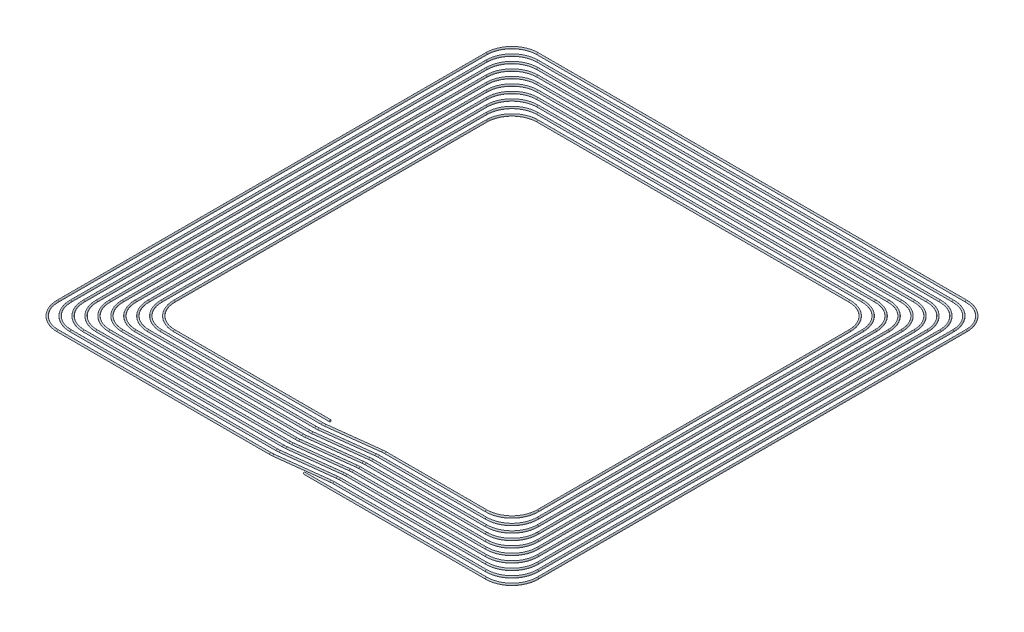
from build123d import *

# Parameters (mm, degrees)
SKETCH_2_R = 0.5


with BuildPart() as part:
    # 扫描1: sweep along a path in 草图1
    with BuildLine(Plane(origin=(0, 0, 0), x_dir=(1, 0, 0), z_dir=(0, 1, 0))) as sweep_1_path:
        Line((140, -245.98), (49.02, -245.98))
        ThreePointArc((49.02, -245.98), (38.413398282, -241.586601718), (34.02, -230.98))
        Line((34.02, -230.98), (34.02, -49.02))
        ThreePointArc((34.02, -49.02), (38.413398282, -38.413398282), (49.02, -34.02))
        Line((49.02, -34.02), (230.98, -34.02))
        ThreePointArc((230.98, -34.02), (241.586601718, -38.413398282), (245.98, -49.02))
        Line((245.98, -49.02), (245.98, -230.98))
        ThreePointArc((245.98, -230.98), (241.586601718, -241.586601718), (230.98, -245.98))
        Line((230.98, -245.98), (172.337899837, -245.98))
        ThreePointArc((172.337899837, -245.98), (171.441008099, -246.006837835), (170.547325779, -246.087255305))
        Line((170.547325779, -246.087255305), (140.892074735, -249.652744695))
        ThreePointArc((140.892074735, -249.652744695), (139.998392415, -249.733162165), (139.101500677, -249.76))
        Line((139.101500677, -249.76), (45.24, -249.76))
        ThreePointArc((45.24, -249.76), (34.633398282, -245.366601718), (30.24, -234.76))
        Line((30.24, -234.76), (30.24, -45.24))
        ThreePointArc((30.24, -45.24), (34.633398282, -34.633398282), (45.24, -30.24))
        Line((45.24, -30.24), (234.76, -30.24))
        ThreePointArc((234.76, -30.24), (245.366601718, -34.633398282), (249.76, -45.24))
        Line((249.76, -45.24), (249.76, -234.76))
        ThreePointArc((249.76, -234.76), (245.366601718, -245.366601718), (234.76, -249.76))
        Line((234.76, -249.76), (172.337899837, -249.76))
        ThreePointArc((172.337899837, -249.76), (171.441008099, -249.786837835), (170.547325779, -249.867255305))
        Line((170.547325779, -249.867255305), (140.892074735, -253.432744695))
        ThreePointArc((140.892074735, -253.432744695), (139.998392415, -253.513162165), (139.101500677, -253.54))
        Line((139.101500677, -253.54), (41.46, -253.54))
        ThreePointArc((41.46, -253.54), (30.853398282, -249.146601718), (26.46, -238.54))
        Line((26.46, -238.54), (26.46, -41.46))
        ThreePointArc((26.46, -41.46), (30.853398282, -30.853398282), (41.46, -26.46))
        Line((41.46, -26.46), (238.54, -26.46))
        ThreePointArc((238.54, -26.46), (249.146601718, -30.853398282), (253.54, -41.46))
        Line((253.54, -41.46), (253.54, -238.54))
        ThreePointArc((253.54, -238.54), (249.146601718, -249.146601718), (238.54, -253.54))
        Line((238.54, -253.54), (172.337899837, -253.54))
        ThreePointArc((172.337899837, -253.54), (171.441008099, -253.566837835), (170.547325779, -253.647255305))
        Line((170.547325779, -253.647255305), (140.892074735, -257.212744695))
        ThreePointArc((140.892074735, -257.212744695), (139.998392415, -257.293162165), (139.101500677, -257.32))
        Line((139.101500677, -257.32), (37.68, -257.32))
        ThreePointArc((37.68, -257.32), (27.073398282, -252.926601718), (22.68, -242.32))
        Line((22.68, -242.32), (22.68, -37.68))
        ThreePointArc((22.68, -37.68), (27.073398282, -27.073398282), (37.68, -22.68))
        Line((37.68, -22.68), (242.32, -22.68))
        ThreePointArc((242.32, -22.68), (252.926601718, -27.073398282), (257.32, -37.68))
        Line((257.32, -37.68), (257.32, -242.32))
        ThreePointArc((257.32, -242.32), (252.926601718, -252.926601718), (242.32, -257.32))
        Line((242.32, -257.32), (172.337899837, -257.32))
        ThreePointArc((172.337899837, -257.32), (171.441008099, -257.346837835), (170.547325779, -257.427255305))
        Line((170.547325779, -257.427255305), (140.892074735, -260.992744695))
        ThreePointArc((140.892074735, -260.992744695), (139.998392415, -261.073162165), (139.101500677, -261.1))
        Line((139.101500677, -261.1), (33.9, -261.1))
        ThreePointArc((33.9, -261.1), (23.293398282, -256.706601718), (18.9, -246.1))
        Line((18.9, -246.1), (18.9, -33.9))
        ThreePointArc((18.9, -33.9), (23.293398282, -23.293398282), (33.9, -18.9))
        Line((33.9, -18.9), (246.1, -18.9))
        ThreePointArc((246.1, -18.9), (256.706601718, -23.293398282), (261.1, -33.9))
        Line((261.1, -33.9), (261.1, -246.1))
        ThreePointArc((261.1, -246.1), (256.706601718, -256.706601718), (246.1, -261.1))
        Line((246.1, -261.1), (172.337899837, -261.1))
        ThreePointArc((172.337899837, -261.1), (171.441008099, -261.126837835), (170.547325779, -261.207255305))
        Line((170.547325779, -261.207255305), (140.892074735, -264.772744695))
        ThreePointArc((140.892074735, -264.772744695), (139.998392415, -264.853162165), (139.101500677, -264.88))
        Line((139.101500677, -264.88), (30.12, -264.88))
        ThreePointArc((30.12, -264.88), (19.513398282, -260.486601718), (15.12, -249.88))
        Line((15.12, -249.88), (15.12, -30.12))
        ThreePointArc((15.12, -30.12), (19.513398282, -19.513398282), (30.12, -15.12))
        Line((30.12, -15.12), (249.88, -15.12))
        ThreePointArc((249.88, -15.12), (260.486601718, -19.513398282), (264.88, -30.12))
        Line((264.88, -30.12), (264.88, -249.88))
        ThreePointArc((264.88, -249.88), (260.486601718, -260.486601718), (249.88, -264.88))
        Line((249.88, -264.88), (172.337899837, -264.88))
        ThreePointArc((172.337899837, -264.88), (171.441008099, -264.906837835), (170.547325779, -264.987255305))
        Line((170.547325779, -264.987255305), (140.892074735, -268.552744695))
        ThreePointArc((140.892074735, -268.552744695), (139.998392415, -268.633162165), (139.101500677, -268.66))
        Line((139.101500677, -268.66), (26.34, -268.66))
        ThreePointArc((26.34, -268.66), (15.733398282, -264.266601718), (11.34, -253.66))
        Line((11.34, -253.66), (11.34, -26.34))
        ThreePointArc((11.34, -26.34), (15.733398282, -15.733398282), (26.34, -11.34))
        Line((26.34, -11.34), (253.66, -11.34))
        ThreePointArc((253.66, -11.34), (264.266601718, -15.733398282), (268.66, -26.34))
        Line((268.66, -26.34), (268.66, -253.66))
        ThreePointArc((268.66, -253.66), (264.266601718, -264.266601718), (253.66, -268.66))
        Line((253.66, -268.66), (172.337899837, -268.66))
        ThreePointArc((172.337899837, -268.66), (171.441008099, -268.686837835), (170.547325779, -268.767255305))
        Line((170.547325779, -268.767255305), (140.892074735, -272.332744695))
        ThreePointArc((140.892074735, -272.332744695), (139.998392415, -272.413162165), (139.101500677, -272.44))
        Line((139.101500677, -272.44), (22.56, -272.44))
        ThreePointArc((22.56, -272.44), (11.953398282, -268.046601718), (7.56, -257.44))
        Line((7.56, -257.44), (7.56, -22.56))
        ThreePointArc((7.56, -22.56), (11.953398282, -11.953398282), (22.56, -7.56))
        Line((22.56, -7.56), (257.44, -7.56))
        ThreePointArc((257.44, -7.56), (268.046601718, -11.953398282), (272.44, -22.56))
        Line((272.44, -22.56), (272.44, -257.44))
        ThreePointArc((272.44, -257.44), (268.046601718, -268.046601718), (257.44, -272.44))
        Line((257.44, -272.44), (172.337899837, -272.44))
        ThreePointArc((172.337899837, -272.44), (171.441008099, -272.466837835), (170.547325779, -272.547255305))
        Line((170.547325779, -272.547255305), (140.892074735, -276.112744695))
        ThreePointArc((140.892074735, -276.112744695), (139.998392415, -276.193162165), (139.101500677, -276.22))
        Line((139.101500677, -276.22), (18.78, -276.22))
        ThreePointArc((18.78, -276.22), (8.173398282, -271.826601718), (3.78, -261.22))
        Line((3.78, -261.22), (3.78, -18.78))
        ThreePointArc((3.78, -18.78), (8.173398282, -8.173398282), (18.78, -3.78))
        Line((18.78, -3.78), (261.22, -3.78))
        ThreePointArc((261.22, -3.78), (271.826601718, -8.173398282), (276.22, -18.78))
        Line((276.22, -18.78), (276.22, -261.22))
        ThreePointArc((276.22, -261.22), (271.826601718, -271.826601718), (261.22, -276.22))
        Line((261.22, -276.22), (172.337899837, -276.22))
        ThreePointArc((172.337899837, -276.22), (171.441008099, -276.246837835), (170.547325779, -276.327255305))
        Line((170.547325779, -276.327255305), (140.892074735, -279.892744695))
        ThreePointArc((140.892074735, -279.892744695), (139.998392415, -279.973162165), (139.101500677, -280))
        Line((139.101500677, -280), (15, -280))
        ThreePointArc((15, -280), (4.393398282, -275.606601718), (0, -265))
        Line((0, -265), (0, -15))
        ThreePointArc((0, -15), (4.393398282, -4.393398282), (15, 0))
        Line((15, 0), (265, 0))
        ThreePointArc((265, 0), (275.606601718, -4.393398282), (280, -15))
        Line((280, -15), (280, -265))
        ThreePointArc((280, -265), (275.606601718, -275.606601718), (265, -280))
        Line((265, -280), (158.818914353, -280))
    # 草图2 → 扫描1 (sweep)
    with BuildSketch(Plane(origin=(140, 0, 0), x_dir=(0, 0, -1), z_dir=(1, 0, 0))):
        with Locations((-245.975192104, 0)):
            Circle(SKETCH_2_R)
    sweep(path=sweep_1_path.line)


solid = part.part
